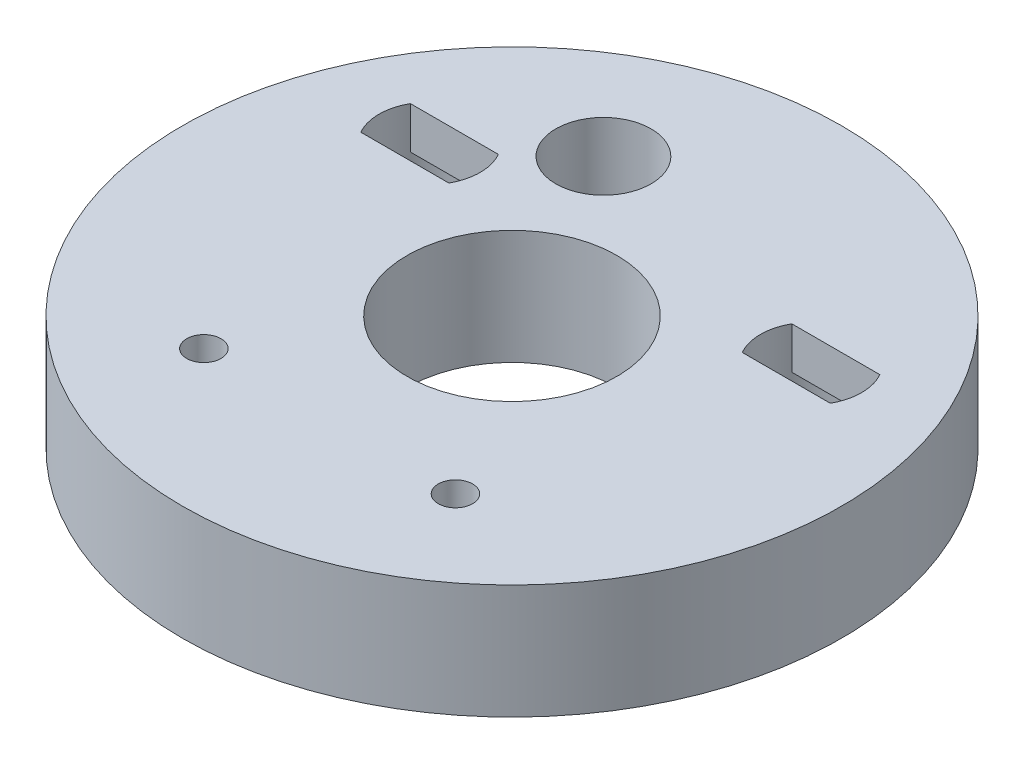
from build123d import *

# Parameters (mm, degrees)
SKETCH_1_R          = 17.28
SKETCH_1_R_2        = 5.5
SKETCH_1_R_3        = 2.65
SKETCH_1_R_4        = 1.9
EXTRUDE_1_DEPTH     = 3.8
SKETCH_2_R          = 2.5
CUT_EXTRUDE_1_DEPTH = 25.731291919
SKETCH_3_R          = 17.28
SKETCH_3_R_2        = 5.5
SKETCH_3_R_3        = 2.5
SKETCH_3_R_4        = 0.9
EXTRUDE_2_DEPTH     = 2.2


with BuildPart() as part:
    # 草图1 → 凸台-拉伸1 (new body)
    with BuildSketch(Plane(origin=(0, 0, 0), x_dir=(1, 0, 0), z_dir=(0, 1, 0))):
        with Locations(Location((0, 0, 0), (0, 0, 90))):
            Circle(SKETCH_1_R)
        with Locations(Location((0, 0, 0), (0, 0, 90))):
            Circle(SKETCH_1_R_2, mode=Mode.SUBTRACT)
        with Locations(Location((-10, 5.678908346, 0), (0, 0, 90))):
            Circle(SKETCH_1_R_3, mode=Mode.SUBTRACT)
        with Locations(Location((-6.595, -9.561091654, 0), (0, 0, 90))):
            Circle(SKETCH_1_R_4, mode=Mode.SUBTRACT)
        with Locations(Location((6.595, -9.561091654, 0), (0, 0, 90))):
            Circle(SKETCH_1_R_4, mode=Mode.SUBTRACT)
        with Locations(Location((10, 5.678908346, 0), (0, 0, 90))):
            Circle(SKETCH_1_R_3, mode=Mode.SUBTRACT)
    extrude(amount=EXTRUDE_1_DEPTH)

    # 草图2 → 切除-拉伸1 (cut, through all)
    with BuildSketch(Plane(origin=(0, 3.8, 0), x_dir=(1, 0, 0), z_dir=(0, 1, 0))):
        with Locations(Location((-4.85, 9.644699566, 0), (0, 0, 270))):
            Circle(SKETCH_2_R)
    extrude(amount=-CUT_EXTRUDE_1_DEPTH, mode=Mode.SUBTRACT)

    # 草图3 → 凸台-拉伸2 (add)
    with BuildSketch(Plane(origin=(0, 3.8, 0), x_dir=(1, 0, 0), z_dir=(0, 1, 0))):
        with Locations(Location((0, 0, 0), (0, 0, 90))):
            Circle(SKETCH_3_R)
        with Locations(Location((0, 0, 0), (0, 0, 90))):
            Circle(SKETCH_3_R_2, mode=Mode.SUBTRACT)
        with Locations(Location((-4.85, 9.644699566, 0), (0, 0, 270))):
            Circle(SKETCH_3_R_3, mode=Mode.SUBTRACT)
        with Locations(Location((-6.595, -9.561091654, 0), (0, 0, 270))):
            Circle(SKETCH_3_R_4, mode=Mode.SUBTRACT)
        with Locations(Location((6.595, -9.561091654, 0), (0, 0, 90))):
            Circle(SKETCH_3_R_4, mode=Mode.SUBTRACT)
        with BuildLine():
            Line((-12.309220648, 4.378908346), (-7.690779352, 4.378908346))
            ThreePointArc((-7.690779352, 4.378908346), (-7.35, 5.678908346), (-7.690779352, 6.978908346))
            Line((-7.690779352, 6.978908346), (-12.309220648, 6.978908346))
            ThreePointArc((-12.309220648, 6.978908346), (-12.65, 5.678908346), (-12.309220648, 4.378908346))
        make_face(mode=Mode.SUBTRACT)
        with BuildLine():
            Line((12.309220648, 4.378908346), (7.690779352, 4.378908346))
            ThreePointArc((7.690779352, 4.378908346), (7.35, 5.678908346), (7.690779352, 6.978908346))
            Line((7.690779352, 6.978908346), (12.309220648, 6.978908346))
            ThreePointArc((12.309220648, 6.978908346), (12.65, 5.678908346), (12.309220648, 4.378908346))
        make_face(mode=Mode.SUBTRACT)
    extrude(amount=EXTRUDE_2_DEPTH)


solid = part.part
